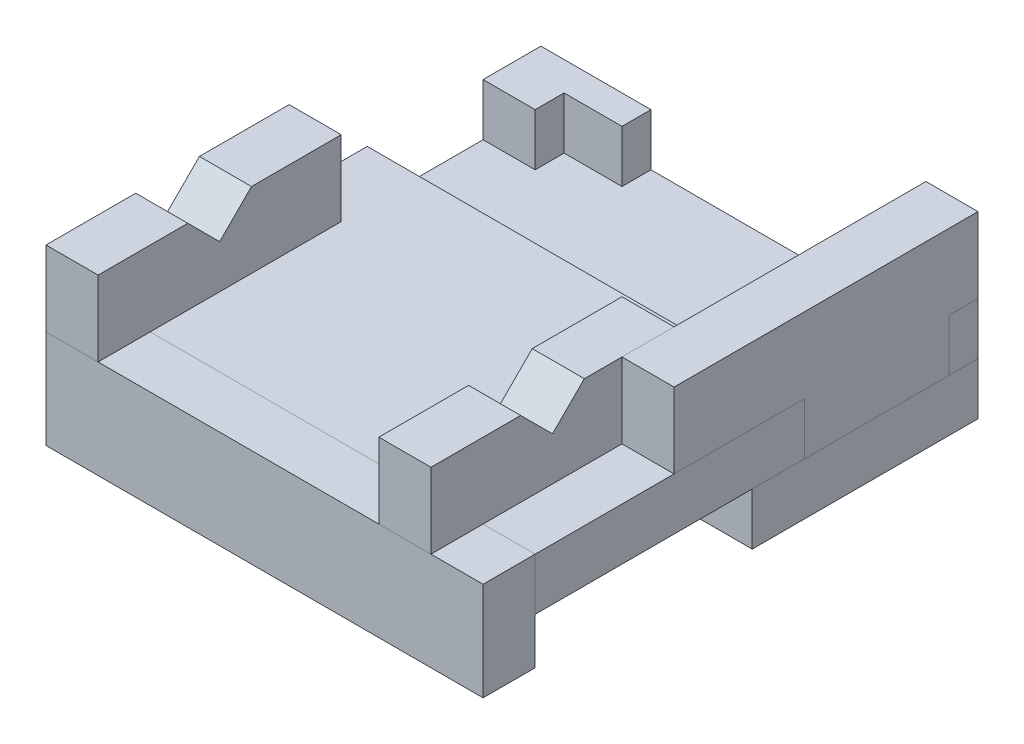
from build123d import *

# Parameters (mm, degrees)
SKETCH1_W             = 151
SKETCH1_H             = 93
BOSS_EXTRUDE1_DEPTH   = 18
BOSS_EXTRUDE2_DEPTH   = 18
SKETCH3_W             = 18
SKETCH3_H             = 34
BOSS_EXTRUDE3_DEPTH   = 151
SKETCH3_W_2           = 78
SKETCH3_H_2           = 18
BOSS_EXTRUDE3_2_DEPTH = 151
BOSS_EXTRUDE4_DEPTH   = 18
BOSS_EXTRUDE5_DEPTH   = 18
BOSS_EXTRUDE6_DEPTH   = 18
SKETCH7_W             = 30
SKETCH7_H             = 10
BOSS_EXTRUDE6_2_DEPTH = 18


with BuildPart() as part:
    # Sketch1 → Boss-Extrude1 (new body)
    with BuildSketch(Plane(origin=(0, 0, 0), x_dir=(1, 0, 0), z_dir=(0, 1, 0))):
        with Locations((22.5, 27.5)):
            Rectangle(SKETCH1_W, SKETCH1_H)
    extrude(amount=BOSS_EXTRUDE1_DEPTH)


with BuildPart() as body_2:
    # Sketch2 → Boss-Extrude2 (new body)
    with BuildSketch(Plane(origin=(80, 0, 0), x_dir=(0, 0, -1), z_dir=(1, 0, 0))):
        Polygon((-37, 18), (47, 18), (47, 44), (16, 44), (5, 33), (-6, 44), (-37, 44), align=None)
    extrude(amount=-BOSS_EXTRUDE2_DEPTH)


with BuildPart() as body_3:
    # Sketch3 → Boss-Extrude3 (new body)
    with BuildSketch(Plane(origin=(98, 0, 0), x_dir=(0, 0, -1), z_dir=(1, 0, 0))):
        with Locations((-28, 1)):
            Rectangle(SKETCH3_W, SKETCH3_H)
    extrude(amount=-BOSS_EXTRUDE3_DEPTH)


with BuildPart() as body_4:
    # Sketch3 → Boss-Extrude3 2 (new body)
    with BuildSketch(Plane(origin=(98, 0, 0), x_dir=(0, 0, -1), z_dir=(1, 0, 0))):
        with Locations((95, -9)):
            Rectangle(SKETCH3_W_2, SKETCH3_H_2)
    extrude(amount=-BOSS_EXTRUDE3_2_DEPTH)


with BuildPart() as body_5:
    # Sketch4 → Boss-Extrude4 (new body)
    with BuildSketch(Plane.ZY.offset(53)):
        Polygon((37, 18), (37, 44), (6, 44), (-5, 33), (-16, 44), (-47, 44), (-47, 18), align=None)
    extrude(amount=-BOSS_EXTRUDE4_DEPTH)


with BuildPart() as body_6:
    # Sketch5 → Boss-Extrude5 (new body)
    with BuildSketch(Plane(origin=(98, 0, 0), x_dir=(0, 0, -1), z_dir=(1, 0, 0))):
        Polygon((124, 0), (74, 0), (74, 18), (29, 18), (29, 44), (134, 44), (134, 18), (124, 18), align=None)
    extrude(amount=-BOSS_EXTRUDE5_DEPTH)


with BuildPart() as body_7:
    # Sketch7 → Boss-Extrude6 (new body)
    with BuildSketch(Plane(origin=(0, 0, 0), x_dir=(1, 0, 0), z_dir=(0, 1, 0))):
        Polygon((-35, 114), (-35, 124), (-15, 124), (-15, 134), (-53, 134), (-53, 114), align=None)
    extrude(amount=BOSS_EXTRUDE6_DEPTH)


with BuildPart() as body_8:
    # Sketch7 → Boss-Extrude6 2 (new body)
    with BuildSketch(Plane(origin=(0, 0, 0), x_dir=(1, 0, 0), z_dir=(0, 1, 0))):
        with Locations((83, 129)):
            Rectangle(SKETCH7_W, SKETCH7_H)
    extrude(amount=BOSS_EXTRUDE6_2_DEPTH)


solid = Compound([part.part, body_2.part, body_3.part, body_4.part, body_5.part, body_6.part, body_7.part, body_8.part])
